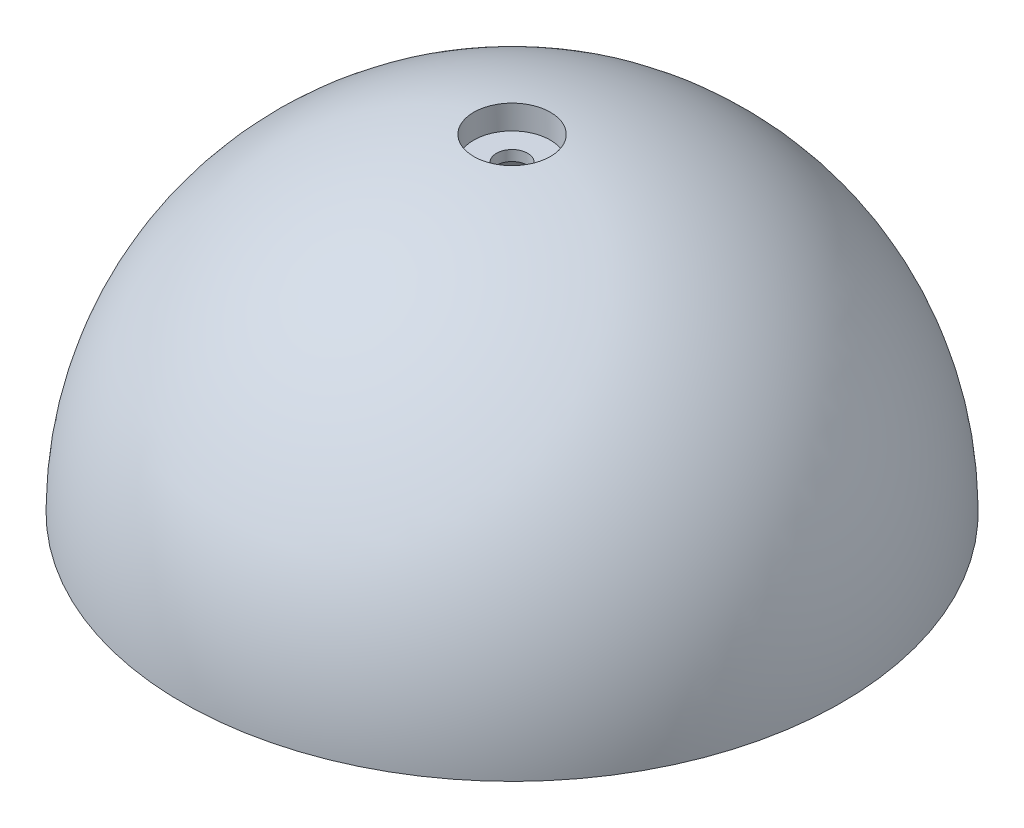
from build123d import *

# Parameters (mm, degrees)
SKETCH2_W              = 242.645613954
SKETCH2_H              = 231.138030636
CUT_IN_HALF_DEPTH      = 165.544826719
SKETCH3_R              = 11
BALLBEARINGHOLE_DEPTH  = 165.544826719
SKETCH4_R              = 31.202879122
SUPPORTFORHOLE_DEPTH   = 4
SKETCH5_R              = 11.05
F_2NDBEARINGHOLE_DEPTH = 7
SKETCH6_R              = 4.5
INSIDEHOLE_DEPTH       = 161.277134988


with BuildPart() as part:
    # Half Circle → Sphere Revolve (revolve)
    with BuildSketch(Plane.XY):
        with BuildLine():
            Line((0, 85), (0, 95))
            ThreePointArc((0, 95), (-95, 0), (0, -95))
            Line((0, -95), (0, -85))
            ThreePointArc((0, -85), (-85, 0), (0, 85))
        make_face()
    revolve(axis=Axis((0, 85, 0), (0, 1, 0)))

    # Sketch2 → Cut in Half (cut, through all)
    with BuildSketch(Plane(origin=(0, 0, 0), x_dir=(1, 0, 0), z_dir=(0, 1, 0))):
        Rectangle(SKETCH2_W, SKETCH2_H)
    extrude(amount=-CUT_IN_HALF_DEPTH, mode=Mode.SUBTRACT)

    # Sketch3 → BallBearingHole (cut, through all)
    with BuildSketch(Plane(origin=(0, 0, 0), x_dir=(1, 0, 0), z_dir=(0, 1, 0))):
        with Locations(Location((0, 0, 0), (0, 0, 90))):
            Circle(SKETCH3_R)
    extrude(amount=BALLBEARINGHOLE_DEPTH, mode=Mode.SUBTRACT)

    # Sketch4 → SupportForHole (add)
    with BuildSketch(Plane(origin=(0, 84.4, 0), x_dir=(1, 0, 0), z_dir=(0, 1, 0))):
        Circle(SKETCH4_R)
    extrude(amount=SUPPORTFORHOLE_DEPTH)

    # Sketch5 → 2ndBearingHole (cut)
    with BuildSketch(Plane(origin=(0, 94.4, 0), x_dir=(1, 0, 0), z_dir=(0, 1, 0))):
        with Locations(Location((0, 0, 0), (0, 0, 270))):
            Circle(SKETCH5_R)
    extrude(amount=-F_2NDBEARINGHOLE_DEPTH, mode=Mode.SUBTRACT)

    # Sketch6 → InsideHole (cut, through all)
    with BuildSketch(Plane(origin=(0, 87.4, 0), x_dir=(1, 0, 0), z_dir=(0, 1, 0))):
        with Locations(Location((0, 0, 0), (0, 0, 270))):
            Circle(SKETCH6_R)
    extrude(amount=-INSIDEHOLE_DEPTH, mode=Mode.SUBTRACT)


solid = part.part
